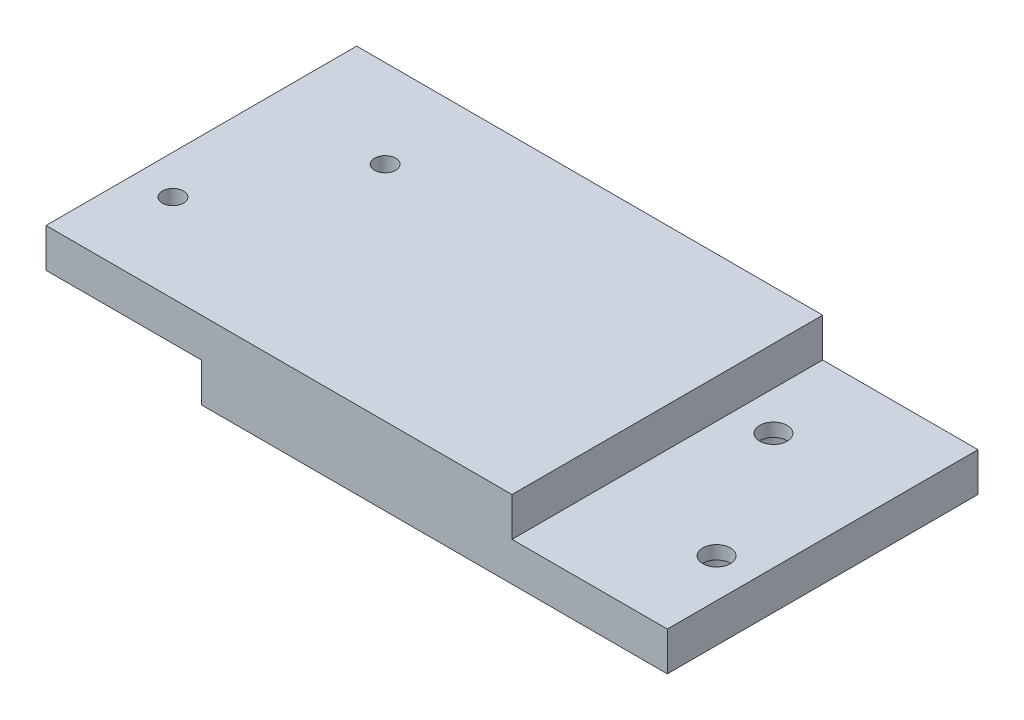
from build123d import *

# Parameters (mm, degrees)
BOSS_EXTRUDE1_DEPTH                            = 50.8
F_8_32_TAPPED_HOLE1_D                          = 3.4544
CBORE_FOR_8_SOCKET_HEAD_CAP_SCREW1_D           = 4.4958
CBORE_FOR_8_SOCKET_HEAD_CAP_SCREW1_CBORE_D     = 7.9375
CBORE_FOR_8_SOCKET_HEAD_CAP_SCREW1_CBORE_DEPTH = 4.1656


with BuildPart() as part:
    # Sketch1 → Boss-Extrude1 (new body)
    with BuildSketch(Plane.XY):
        Polygon((25.4, 6.35), (25.4, 0), (101.6, 0), (101.6, 6.35), (76.2, 6.35), (76.2, 12.7), (0, 12.7), (0, 6.35), align=None)
    extrude(amount=BOSS_EXTRUDE1_DEPTH)

    # #8-32 Tapped Hole1 (through all)
    with Locations(Plane(origin=(0, 12.7, 0), x_dir=(1, 0, 0), z_dir=(0, 1, 0))):
        with Locations((6.35, -36.398522628), (19.05, -14.401477372)):
            Hole(F_8_32_TAPPED_HOLE1_D / 2)

    # CBORE for #8 Socket Head Cap Screw1 (through all)
    with Locations(Plane(origin=(0, 0, 0), x_dir=(-1, 0, 0), z_dir=(0, -1, 0))):
        with Locations((-95.25, -36.398522628), (-82.55, -14.401477372)):
            CounterBoreHole(CBORE_FOR_8_SOCKET_HEAD_CAP_SCREW1_D / 2, CBORE_FOR_8_SOCKET_HEAD_CAP_SCREW1_CBORE_D / 2, CBORE_FOR_8_SOCKET_HEAD_CAP_SCREW1_CBORE_DEPTH)


solid = part.part
